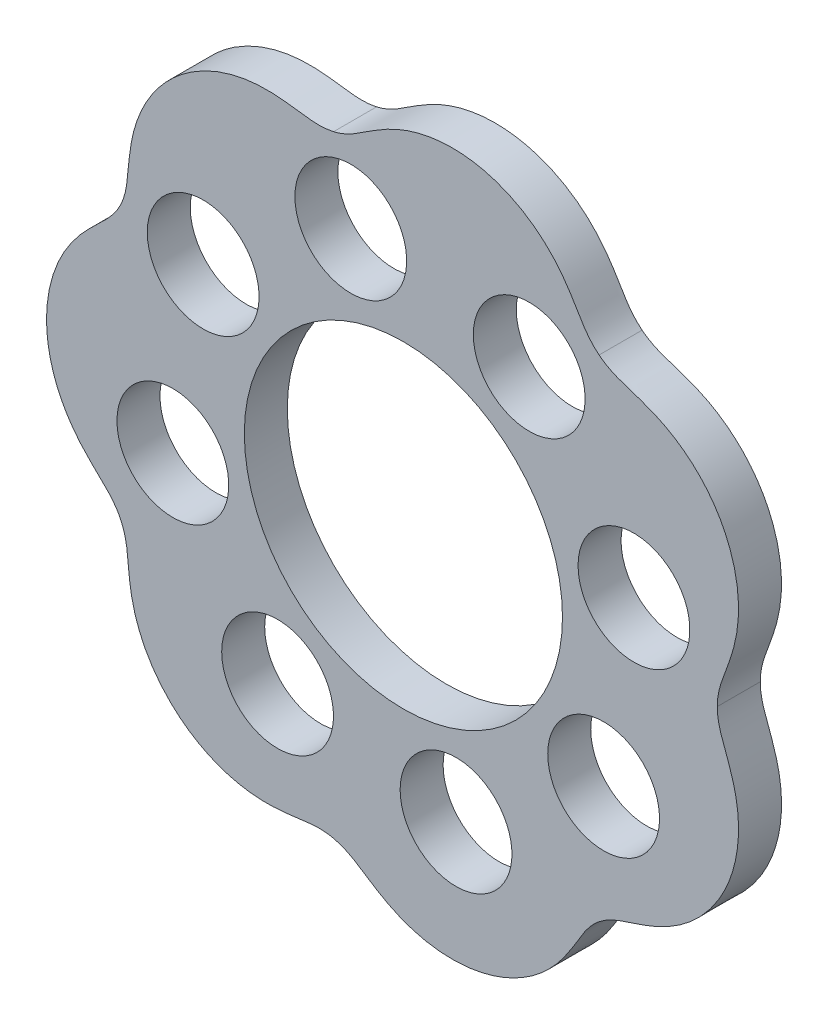
from build123d import *

# Parameters (mm, degrees)
BOSS_EXTRUDE1_DEPTH = 5
SKETCH_2_R          = 6.5
SKETCH_2_R_2        = 18.5
CUT_EXTRUDE_1_DEPTH = 59.453931515


with BuildPart() as part:
    # Sketch1 → Boss-Extrude1 (new body)
    with BuildSketch(Plane.XY):
        with BuildLine():
            add(Edge.make_bspline(
                [(22.757377772, -28.536849113), (22.893927625, -28.427954239), (23.170237205, -28.223608021), (23.792205739, -27.831190064), (24.483430721, -27.492747002), (25.246715394, -27.190394662), (26.142925149, -26.882970154), (27.123173642, -26.572717929), (28.193300358, -26.204679267), (29.202443655, -25.804196744), (30.490144535, -25.206078697), (32.003343519, -24.321190723), (33.659923311, -23.033037579), (35.623392558, -21.037807065), (37.556262354, -18.086148296), (38.658868424, -14.734605123), (38.994542018, -11.955534747), (38.968897725, -9.857272816), (38.717073216, -8.122159686), (38.382071531, -6.742902251), (38.065759728, -5.703893034), (37.686532124, -4.638198633), (37.317777206, -3.67791016), (36.999382153, -2.785931228), (36.75985001, -1.999911914), (36.593854183, -1.251859124), (36.512490543, -0.517784962), (36.5, -0.174713558), (36.5, -1e-09)],
                knots=[0.049242836, 0.049242836, 0.049242836, 0.049242836, 0.056285917, 0.063328998, 0.077415159, 0.09150132, 0.105587482, 0.133759804, 0.161932127, 0.19010445, 0.218276773, 0.274621418, 0.330966064, 0.387310709, 0.5, 0.612689291, 0.669033936, 0.725378582, 0.781723227, 0.80989555, 0.838067873, 0.866240196, 0.894412518, 0.90849868, 0.922584841, 0.936671002, 0.943714083, 0.950757164, 0.950757164, 0.950757164, 0.950757164], degree=3))
            add(Edge.make_bspline(
                [(36.5, -1e-09), (36.5, 0.174653817), (36.512511899, 0.518089129), (36.593498224, 1.249032304), (36.75986451, 2.000469553), (36.999376141, 2.785743142), (37.317799625, 3.678104189), (37.686409607, 4.63793242), (38.065878488, 5.704059529), (38.381959198, 6.742736298), (38.717200046, 8.122421888), (38.968830904, 9.857207121), (38.994572829, 11.955523704), (38.65884185, 14.734631654), (37.556266705, 18.086139253), (35.623388379, 21.03784438), (33.65991273, 23.033006602), (32.003436538, 24.321202002), (30.489860455, 25.206143016), (29.202643436, 25.804181096), (28.193096136, 26.204690221), (27.123458159, 26.572647733), (26.142759468, 26.883073598), (25.246866189, 27.19028209), (24.482985696, 27.493083346), (23.794637768, 27.829705868), (23.169986078, 28.223780967), (22.893974327, 28.427916989), (22.757377768, 28.53684911)],
                knots=[0.049242836, 0.049242836, 0.049242836, 0.049242836, 0.056285917, 0.063328998, 0.077415159, 0.09150132, 0.105587482, 0.133759804, 0.161932127, 0.19010445, 0.218276773, 0.274621418, 0.330966064, 0.387310709, 0.5, 0.612689291, 0.669033936, 0.725378582, 0.781723227, 0.80989555, 0.838067873, 0.866240196, 0.894412518, 0.90849868, 0.922584841, 0.936671002, 0.943714083, 0.950757164, 0.950757164, 0.950757164, 0.950757164], degree=3))
            add(Edge.make_bspline(
                [(22.757377768, 28.53684911), (22.620832651, 28.645739731), (22.360124621, 28.869649837), (21.839143201, 29.388702102), (21.355372251, 29.987285048), (20.890752224, 30.664151961), (20.3916083, 31.469482523), (19.871006979, 32.356115532), (19.274068053, 33.317514492), (18.659068897, 34.212239533), (17.789403892, 35.334559572), (16.589980381, 36.612910988), (14.96549693, 37.941312436), (12.583374174, 39.411567729), (9.275612144, 40.639163175), (5.762744736, 40.968327848), (2.978657205, 40.677177308), (0.938710259, 40.1852637), (-0.696862539, 39.553649811), (-1.966993013, 38.920130381), (-2.909565132, 38.380545399), (-3.864153324, 37.773683957), (-4.718309307, 37.200487793), (-5.517075065, 36.691589411), (-6.230087722, 36.283155131), (-6.922447402, 35.95486293), (-7.620015956, 35.71219083), (-7.95170017, 35.623674735), (-8.122031107, 35.584797429)],
                knots=[0.049242836, 0.049242836, 0.049242836, 0.049242836, 0.056285918, 0.063329, 0.077415165, 0.091501329, 0.105587493, 0.133759821, 0.16193215, 0.190104478, 0.218276806, 0.274621463, 0.33096612, 0.387310777, 0.50000009, 0.612689403, 0.66903406, 0.725378717, 0.781723374, 0.809895702, 0.83806803, 0.866240359, 0.894412687, 0.908498851, 0.922585015, 0.93667118, 0.943714262, 0.950757344, 0.950757344, 0.950757344, 0.950757344], degree=3))
            add(Edge.make_bspline(
                [(-8.122031107, 35.584797429), (-8.292303944, 35.545934241), (-8.629906203, 35.481712141), (-9.360549053, 35.3980177), (-10.130165973, 35.393003612), (-10.949049596, 35.451771934), (-11.889894101, 35.563645227), (-12.90768147, 35.709434371), (-14.031518414, 35.842156881), (-15.114488006, 35.919188703), (-16.534180306, 35.939019714), (-18.281464597, 35.79832091), (-20.332901658, 35.356504225), (-22.967627485, 34.410788871), (-25.989765467, 32.590085845), (-28.437367065, 30.048859636), (-29.945599067, 27.690651276), (-30.832901756, 25.789058383), (-31.358858011, 24.116514309), (-31.65547332, 22.728495317), (-31.821298503, 21.655138296), (-31.942016841, 20.530440601), (-32.026436404, 19.50525442), (-32.126589777, 18.563463634), (-32.251821439, 17.751356674), (-32.42683362, 17.005362538), (-32.672031259, 16.30868321), (-32.809631405, 15.994167159), (-32.885437034, 15.836755763)],
                knots=[0.049242656, 0.049242656, 0.049242656, 0.049242656, 0.056285738, 0.063328819, 0.077414982, 0.091501144, 0.105587307, 0.133759632, 0.161931958, 0.190104283, 0.218276609, 0.274621259, 0.33096591, 0.387310561, 0.499999863, 0.612689164, 0.669033815, 0.725378466, 0.781723116, 0.809895442, 0.838067767, 0.866240093, 0.894412418, 0.908498581, 0.922584743, 0.936670906, 0.943713988, 0.950757069, 0.950757069, 0.950757069, 0.950757069], degree=3))
            add(Edge.make_bspline(
                [(-32.885437034, 15.836755763), (-32.961216335, 15.67939802), (-33.121499885, 15.375401836), (-33.511609224, 14.751983794), (-33.987535131, 14.147145699), (-34.544043418, 13.543558598), (-35.218112181, 12.877727047), (-35.966670266, 12.17288432), (-36.77113312, 11.37698078), (-37.506575004, 10.578306089), (-38.407237057, 9.48070597), (-39.386640277, 8.026894927), (-40.32025399, 6.147544075), (-41.223574455, 3.497984339), (-41.684345289, -9.761e-06), (-41.22357121, -3.498047262), (-40.320203472, -6.147544192), (-39.386693006, -8.026883982), (-38.406966526, -9.480902052), (-37.506700775, -10.578216222), (-36.77090283, -11.377086974), (-35.966841455, -12.172701972), (-35.21794975, -12.877893584), (-34.544069197, -13.543390927), (-33.987215954, -14.147639542), (-33.513089709, -14.749587875), (-33.12127947, -15.375662595), (-32.961172148, -15.679339431), (-32.885366449, -15.836750728)],
                knots=[0.049242931, 0.049242931, 0.049242931, 0.049242931, 0.056286011, 0.063329091, 0.077415251, 0.091501411, 0.105587571, 0.13375989, 0.16193221, 0.19010453, 0.21827685, 0.274621489, 0.330966129, 0.387310768, 0.500000047, 0.612689326, 0.669033966, 0.725378606, 0.781723245, 0.809895565, 0.838067885, 0.866240204, 0.894412524, 0.908498684, 0.922584844, 0.936671004, 0.943714084, 0.950757164, 0.950757164, 0.950757164, 0.950757164], degree=3))
            add(Edge.make_bspline(
                [(-32.885366449, -15.836750728), (-32.809584225, -15.994114138), (-32.67184606, -16.308967371), (-32.427667859, -17.002663066), (-32.2515223, -17.75186826), (-32.126597382, -18.563295518), (-32.026306081, -19.505443812), (-31.941958336, -20.530153044), (-31.821272768, -21.655345755), (-31.655386687, -22.728303468), (-31.358805111, -24.116812785), (-30.832821578, -25.78897881), (-29.945588805, -27.690665729), (-28.437295896, -30.04888726), (-25.989745367, -32.59010184), (-22.967585312, -34.410851791), (-20.332886434, -35.356510683), (-18.281525917, -35.79841655), (-16.533879472, -35.939004802), (-15.114658013, -35.91931596), (-14.031312928, -35.842136056), (-12.90795163, -35.709555794), (-11.889683905, -35.563730619), (-10.949219183, -35.451802381), (-10.129606098, -35.39318156), (-9.363371007, -35.397805001), (-8.629596503, -35.481828185), (-8.292347209, -35.545991375), (-8.122014085, -35.584868799)],
                knots=[0.049242836, 0.049242836, 0.049242836, 0.049242836, 0.056285917, 0.063328998, 0.077415159, 0.09150132, 0.105587482, 0.133759804, 0.161932127, 0.19010445, 0.218276773, 0.274621418, 0.330966064, 0.387310709, 0.5, 0.612689291, 0.669033936, 0.725378582, 0.781723227, 0.80989555, 0.838067873, 0.866240196, 0.894412518, 0.90849868, 0.922584841, 0.936671002, 0.943714083, 0.950757164, 0.950757164, 0.950757164, 0.950757164], degree=3))
            add(Edge.make_bspline(
                [(-8.122014085, -35.584868799), (-7.951739203, -35.62373293), (-7.619698691, -35.712352675), (-6.92510294, -35.953958662), (-6.229525773, -36.283364316), (-5.517236985, -36.691610703), (-4.718105183, -37.20061966), (-3.864365287, -37.773569694), (-2.909407981, -38.380760098), (-1.967107582, -38.920043329), (-0.696611696, -39.553887915), (0.938685715, -40.185235892), (2.978665004, -40.677251779), (5.762802086, -40.968347973), (9.275626443, -40.63919729), (12.583432051, -39.41159644), (14.965485825, -37.941314587), (16.589984107, -36.613020155), (17.789540165, -35.334310484), (18.659016915, -34.212442676), (19.274129849, -33.317328499), (19.870878739, -32.356386828), (20.391747568, -31.469352555), (20.890608711, -30.664281511), (21.355797508, -29.986932714), (21.837152024, -29.390748665), (22.360344915, -28.869448256), (22.620781213, -28.645781234), (22.757377772, -28.536849113)],
                knots=[0.049242836, 0.049242836, 0.049242836, 0.049242836, 0.056285917, 0.063328998, 0.077415159, 0.09150132, 0.105587482, 0.133759804, 0.161932127, 0.19010445, 0.218276773, 0.274621418, 0.330966064, 0.387310709, 0.5, 0.612689291, 0.669033936, 0.725378582, 0.781723227, 0.80989555, 0.838067873, 0.866240196, 0.894412518, 0.90849868, 0.922584841, 0.936671002, 0.943714083, 0.950757164, 0.950757164, 0.950757164, 0.950757164], degree=3))
        make_face()
    extrude(amount=-BOSS_EXTRUDE1_DEPTH)

    # ｽｹｯﾁ2 → ｶｯﾄ - 押し出し1 (cut, through all)
    with BuildSketch(Plane(origin=(0, 0, -5), x_dir=(-1, 0, 0), z_dir=(0, 0, -1))):
        with Locations((6.119347188, 26.810512677)):
            Circle(SKETCH_2_R)
        with Locations((23.284927214, 14.630863427)):
            Circle(SKETCH_2_R)
        with Locations((26.810512677, -6.119347188)):
            Circle(SKETCH_2_R)
        with Locations((14.630863427, -23.284927214)):
            Circle(SKETCH_2_R)
        with Locations((-6.119347188, -26.810512677)):
            Circle(SKETCH_2_R)
        with Locations((-23.284927214, -14.630863427)):
            Circle(SKETCH_2_R)
        with Locations((-26.810512677, 6.119347188)):
            Circle(SKETCH_2_R)
        with Locations((-14.630863427, 23.284927214)):
            Circle(SKETCH_2_R)
        Circle(SKETCH_2_R_2)
    extrude(amount=-CUT_EXTRUDE_1_DEPTH, mode=Mode.SUBTRACT)


solid = part.part
